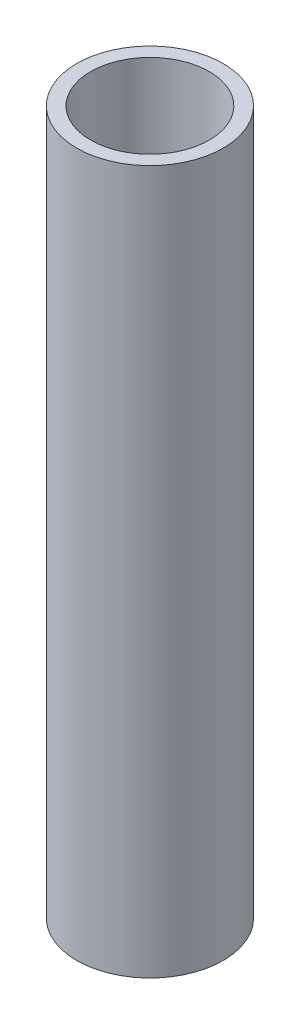
from build123d import *

# Parameters (mm, degrees)
SKETCH2_R               = 0.5
BOSS_EXTRUDE1_DEPTH     = 4.8
CUT_EXTRUDE2_DEPTH      = 5.851803788
CUT_EXTRUDE2_DEPTH_BACK = 10
SKETCH3_R               = 0.405


with BuildPart() as part:
    # Sketch2 → Boss-Extrude1 (new body)
    with BuildSketch(Plane(origin=(0, 0, 0), x_dir=(1, 0, 0), z_dir=(0, 1, 0))):
        with Locations(Location((0, 0, 0), (0, 0, 270))):
            Circle(SKETCH2_R)
    extrude(amount=BOSS_EXTRUDE1_DEPTH)

    # Sketch3 → Cut-Extrude2 (cut, two sides: drawn at the far end of the back side and taken through both)
    with BuildSketch(Plane(origin=(0, 0, 0), x_dir=(1, 0, 0), z_dir=(0, 1, 0)).offset(-CUT_EXTRUDE2_DEPTH_BACK)):
        with Locations(Location((0, 0, 0), (0, 0, 270))):
            Circle(SKETCH3_R)
    extrude(amount=CUT_EXTRUDE2_DEPTH + CUT_EXTRUDE2_DEPTH_BACK, mode=Mode.SUBTRACT)


solid = part.part
